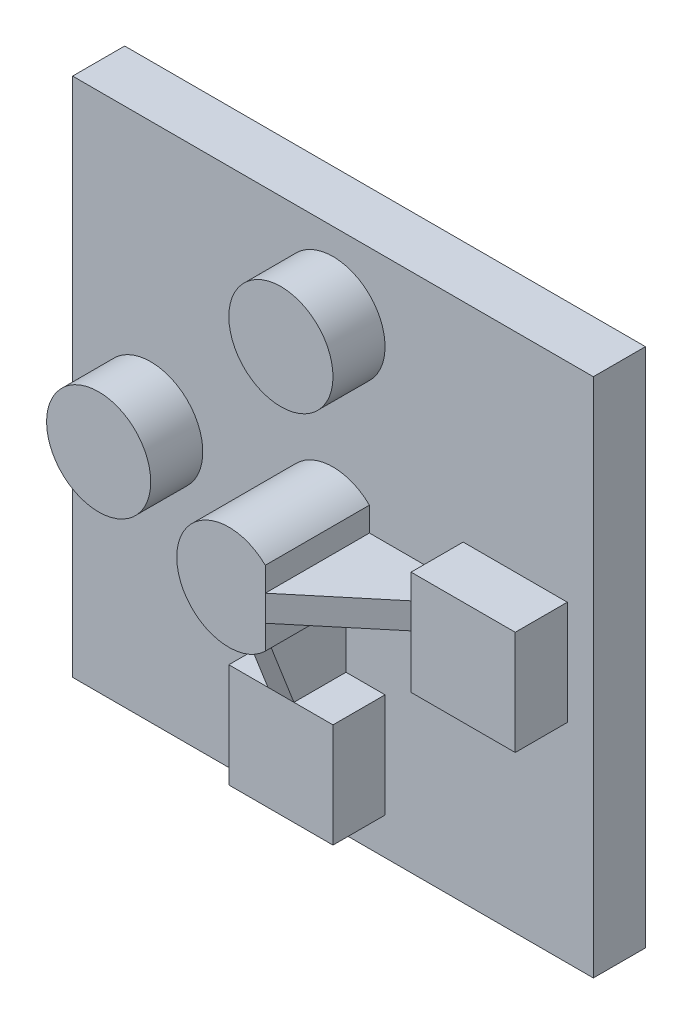
from build123d import *

# Parameters (mm, degrees)
SCHIZZO1_W                   = 100
SCHIZZO1_H                   = 100
ESTRUSIONE_ESTRUSIONE1_DEPTH = 5
SCHIZZO2_W                   = 20
SCHIZZO2_H                   = 20
SCHIZZO2_R                   = 10
ESTRUSIONE_ESTRUSIONE2_DEPTH = 10
ESTRUSIONE_ESTRUSIONE3_DEPTH = 20
NERVATURA6_REACH             = 116.564
SCHIZZO17_WALL_W             = 254.559533776
SCHIZZO17_WALL_H             = 5
NERVATURA7_REACH             = 116.564
SCHIZZO19_WALL_W             = 244.96518431
SCHIZZO19_WALL_H             = 5


with BuildPart() as part:
    # Schizzo1 → Estrusione-Estrusione1 (new, symmetric)
    with BuildSketch(Plane.XY):
        with Locations((50, 50)):
            Rectangle(SCHIZZO1_W, SCHIZZO1_H)
    extrude(amount=ESTRUSIONE_ESTRUSIONE1_DEPTH, both=True)

    # Schizzo2 → Estrusione-Estrusione2 (add)
    with BuildSketch(Plane.XY.offset(5)):
        with Locations((85, 50)):
            Rectangle(SCHIZZO2_W, SCHIZZO2_H)
        with Locations((50, 17.098606554)):
            Rectangle(SCHIZZO2_W, SCHIZZO2_H)
        with Locations((50, 85)):
            Circle(SCHIZZO2_R)
        with Locations((15, 50)):
            Circle(SCHIZZO2_R)
    extrude(amount=ESTRUSIONE_ESTRUSIONE2_DEPTH)

    # Schizzo2<3> → Estrusione-Estrusione3 (add)
    with BuildSketch(Plane.XY.offset(5)):
        with BuildLine():
            Line((57, 42.858571571), (57, 57.141428429))
            ThreePointArc((57, 57.141428429), (40, 50), (57, 42.858571571))
        make_face()
    extrude(amount=ESTRUSIONE_ESTRUSIONE3_DEPTH)

    # Schizzo17 wall → Nervatura6 (add, up to next)
    with BuildSketch(Plane(origin=(66, 50, 17.5), x_dir=(-0.768221279597, 0, 0.640184399664), z_dir=(-0.640184399664, 0, -0.768221279597)), mode=Mode.PRIVATE) as nervatura6_sk1:
        Rectangle(SCHIZZO17_WALL_W, SCHIZZO17_WALL_H)
    nervatura6_tool1 = extrude(nervatura6_sk1.sketch, amount=NERVATURA6_REACH, mode=Mode.PRIVATE) - part.part
    add(nervatura6_tool1.solids().sort_by_distance((66, 50, 17.5))[0])

    # Schizzo19 wall → Nervatura7 (add, up to next)
    with BuildSketch(Plane(origin=(50, 33.549303277, 17.5), x_dir=(0, 0.932424174937, 0.361365684583), z_dir=(0, 0.361365684583, -0.932424174937)), mode=Mode.PRIVATE) as nervatura7_sk1:
        Rectangle(SCHIZZO19_WALL_W, SCHIZZO19_WALL_H)
    nervatura7_tool1 = extrude(nervatura7_sk1.sketch, amount=NERVATURA7_REACH, mode=Mode.PRIVATE) - part.part
    add(nervatura7_tool1.solids().sort_by_distance((50, 33.549303277, 17.5))[0])


solid = part.part
